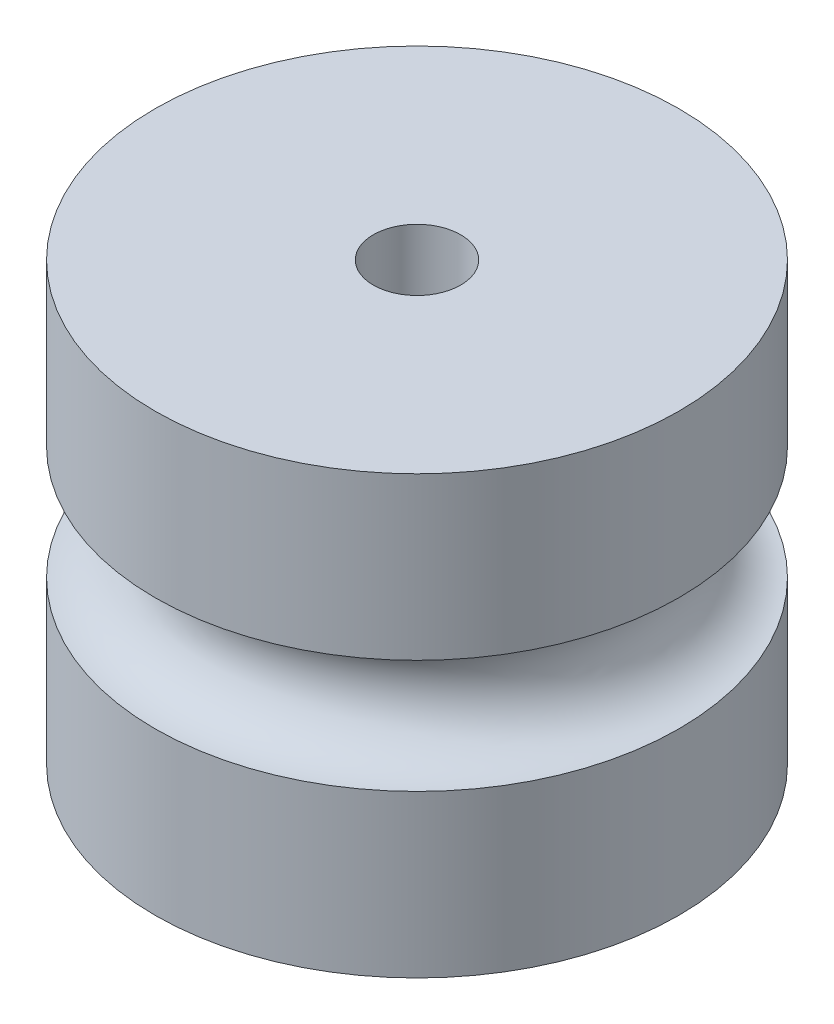
from build123d import *

# Parameters (mm, degrees)
SKETCH1_R           = 3
SKETCH1_R_2         = 0.5
BOSS_EXTRUDE1_DEPTH = 5
SKETCH2_R           = 0.65


with BuildPart() as part:
    # Sketch1 → Boss-Extrude1 (new body)
    with BuildSketch(Plane(origin=(0, 0, 0), x_dir=(1, 0, 0), z_dir=(0, 1, 0))):
        with Locations(Location((0, 0, 0), (0, 0, 270))):
            Circle(SKETCH1_R)
        with Locations(Location((0, 0, 0), (0, 0, 270))):
            Circle(SKETCH1_R_2, mode=Mode.SUBTRACT)
    extrude(amount=BOSS_EXTRUDE1_DEPTH)

    # Sketch2 → Cut-Revolve1 (revolve, cut)
    with BuildSketch(Plane.XY, mode=Mode.PRIVATE) as cut_revolve1_sk:
        with Locations((3, 2.5)):
            Circle(SKETCH2_R)
    revolve(cut_revolve1_sk.sketch.rotate(Axis((0, 0, 0), (0, 1, 0)), 90), axis=Axis((0, 0, 0), (0, 1, 0)), mode=Mode.SUBTRACT)


solid = part.part
